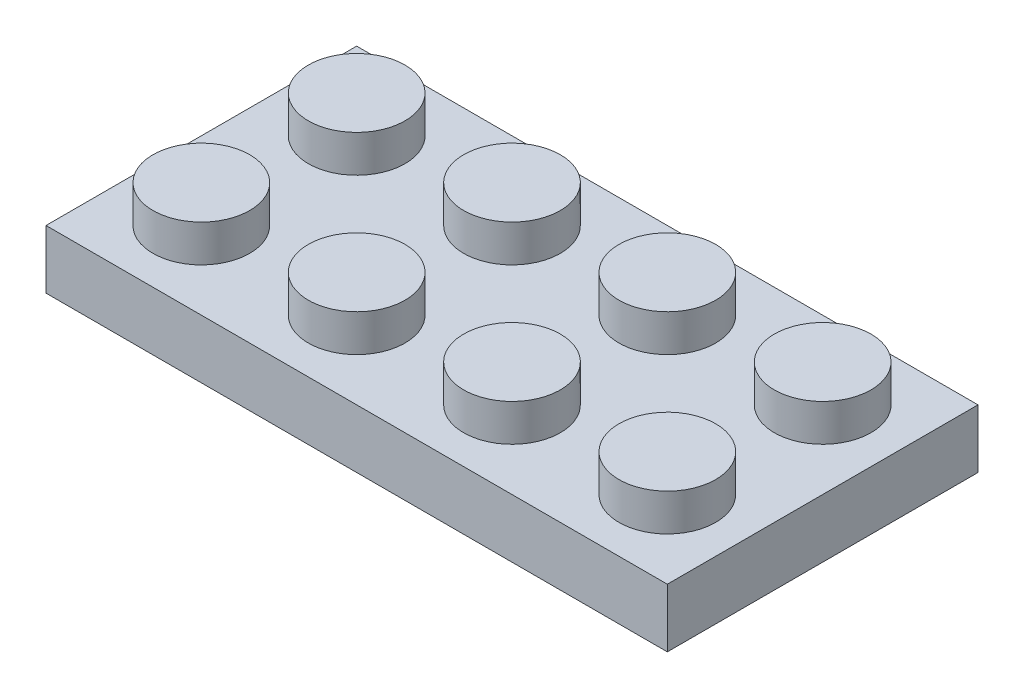
from build123d import *

# Parameters (mm, degrees)
SKETCH1_W           = 31.8
SKETCH1_H           = 15.9
BOSS_EXTRUDE1_DEPTH = 3
SKETCH2_R           = 2.475
BOSS_EXTRUDE2_DEPTH = 1.9
SKETCH3_W           = 28.8
SKETCH3_H           = 12.9
CUT_EXTRUDE1_DEPTH  = 2


with BuildPart() as part:
    # Sketch1 → Boss-Extrude1 (new body)
    with BuildSketch(Plane(origin=(0, 0, 0), x_dir=(1, 0, 0), z_dir=(0, 1, 0))):
        with Locations((15.9, -7.95)):
            Rectangle(SKETCH1_W, SKETCH1_H)
    extrude(amount=BOSS_EXTRUDE1_DEPTH)

    # Sketch2 → Boss-Extrude2 (add)
    with BuildSketch(Plane(origin=(0, 3, 0), x_dir=(1, 0, 0), z_dir=(0, 1, 0))):
        with Locations(Location((3.975, -3.975, 0), (0, 0, 90))):
            Circle(SKETCH2_R)
        with Locations(Location((11.925, -3.975, 0), (0, 0, 90))):
            Circle(SKETCH2_R)
        with Locations(Location((19.875, -3.975, 0), (0, 0, 90))):
            Circle(SKETCH2_R)
        with Locations(Location((27.825, -3.975, 0), (0, 0, 90))):
            Circle(SKETCH2_R)
        with Locations(Location((27.825, -11.925, 0), (0, 0, 90))):
            Circle(SKETCH2_R)
        with Locations(Location((19.875, -11.925, 0), (0, 0, 90))):
            Circle(SKETCH2_R)
        with Locations(Location((11.925, -11.925, 0), (0, 0, 90))):
            Circle(SKETCH2_R)
        with Locations(Location((3.975, -11.925, 0), (0, 0, 90))):
            Circle(SKETCH2_R)
    extrude(amount=BOSS_EXTRUDE2_DEPTH)

    # Sketch3 → Cut-Extrude1 (cut)
    with BuildSketch(Plane.XZ):
        with Locations((15.9, 7.95)):
            Rectangle(SKETCH3_W, SKETCH3_H)
    extrude(amount=-CUT_EXTRUDE1_DEPTH, mode=Mode.SUBTRACT)


solid = part.part
